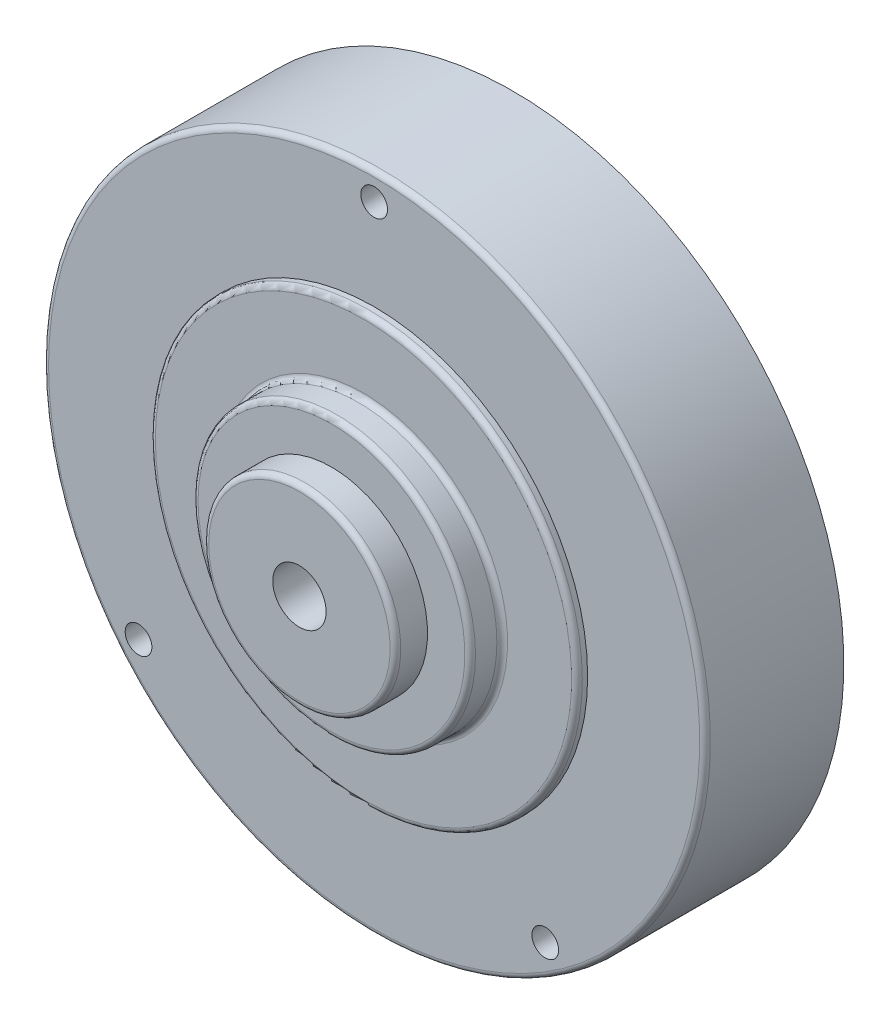
from build123d import *

# Parameters (mm, degrees)
ESQUISSE2_R             = 2.5
ENL_V_MAT_EXTRU_1_DEPTH = 49.187135213
CONG_1_R                = 0.5
ESQUISSE3_R             = 1.25
ENL_V_MAT_EXTRU_2_DEPTH = 5


with BuildPart() as part:
    # Esquisse1 → Révolution1 (revolve)
    with BuildSketch(Plane(origin=(0, 0, 0), x_dir=(1, 0, 0), z_dir=(0, 1, 0)), mode=Mode.PRIVATE) as r_volution1_sk:
        Polygon((0, 0), (31, 0), (31, -13), (20, -13), (20, -14), (13, -14), (13, -17), (9, -17), (9, -20), (0, -20), align=None)
    revolve(r_volution1_sk.sketch.rotate(Axis((0, 0, 0), (0, 0, 1)), 180), axis=Axis((0, 0, 0), (0, 0, 1)))

    # Esquisse2 → Enlèv. mat.-Extru.1 (cut, through all)
    with BuildSketch(Plane.XY.offset(20)):
        Circle(ESQUISSE2_R)
    extrude(amount=-ENL_V_MAT_EXTRU_1_DEPTH, mode=Mode.SUBTRACT)

    # Congé1
    cong_1_edges = [part.edges().sort_by_distance(p)[0] for p in [
        (9, 0, 20),
        (13, 0, 17),
        (13, 0, 14),
        (20, 0, 14),
        (31, 0, 13),
    ]]
    fillet(cong_1_edges, radius=CONG_1_R)

    # Esquisse3 → Enlèv. mat.-Extru.2 (cut)
    with BuildSketch(Plane.XY.offset(13)):
        with Locations((0, 28.5)):
            Circle(ESQUISSE3_R)
        with Locations((-22.07133422, -18.030701754)):
            Circle(ESQUISSE3_R)
        with Locations((16.028756412, -23.565418899)):
            Circle(ESQUISSE3_R)
    extrude(amount=-ENL_V_MAT_EXTRU_2_DEPTH, mode=Mode.SUBTRACT)


solid = part.part
